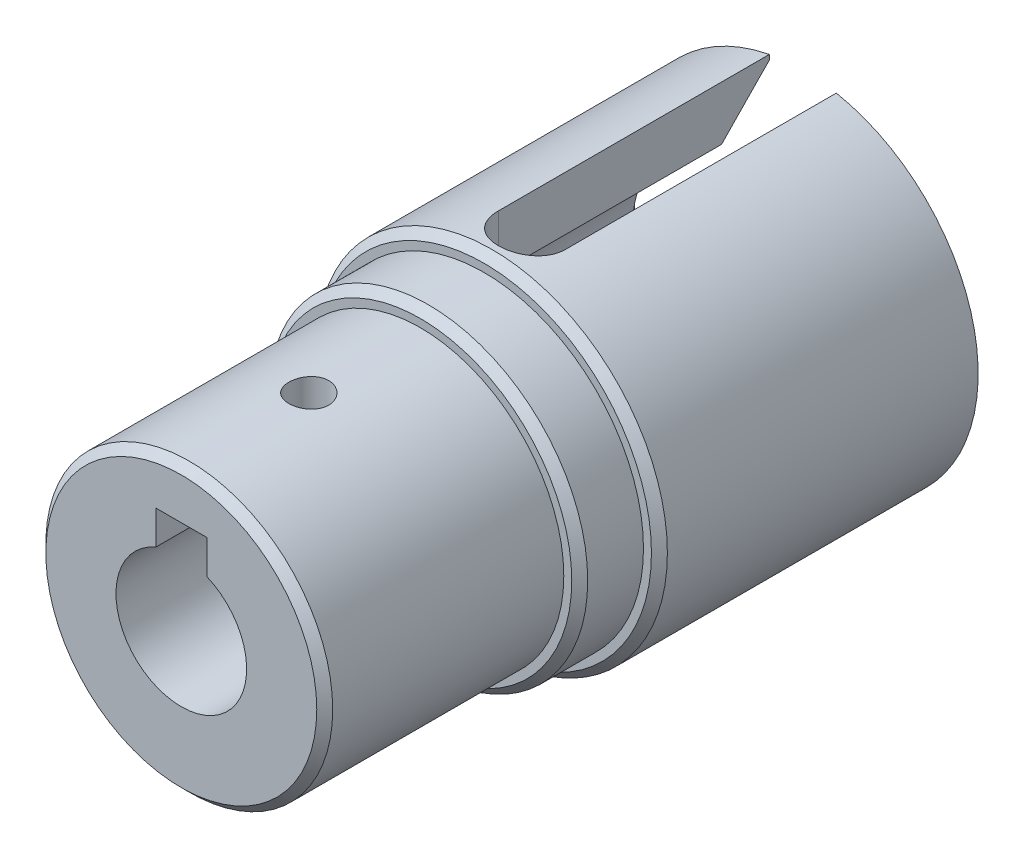
from build123d import *

# Parameters (mm, degrees)
SKETCH_1_R           = 11
EXTRUDE_1_DEPTH      = 29
SKETCH_2_OUTSIDE_W   = 32.506
SKETCH_2_OUTSIDE_H   = 32.506
SKETCH_2_OUTSIDE_R   = 10
CUT_EXTRUDE_1_DEPTH  = 9
SKETCH_3_R           = 7.7
CUT_EXTRUDE_2_DEPTH  = 20
SKETCH_4_R           = 2.1
CUT_EXTRUDE_3_DEPTH  = 25
CHAMFER_1_SIZE       = 3
EXTRUDE_START        = 10
SKETCH_5_R           = 10
EXTRUDE_2_DEPTH      = 10
SKETCH_6_R           = 4
CUT_EXTRUDE_5_DEPTH  = 19
SKETCH_8_OUTSIDE_W   = 33.978
SKETCH_8_OUTSIDE_H   = 33.978
SKETCH_8_OUTSIDE_R   = 9
CUT_EXTRUDE_7_DEPTH  = 15
SKETCH_9_R           = 1.25
CUT_EXTRUDE_8_DEPTH  = 25
CHAMFER_3_SIZE       = 0.5
CUT_EXTRUDE_9_DEPTH  = 19
CUT_EXTRUDE_10_DEPTH = 19


with BuildPart() as part:
    # 草图1 → 凸台-拉伸1 (new body)
    with BuildSketch(Plane.XY):
        with Locations(Location((0, 0, 0), (0, 0, 180))):
            Circle(SKETCH_1_R)
    extrude(amount=EXTRUDE_1_DEPTH)

    # 草图2 outside → 切除-拉伸1 (cut)
    with BuildSketch(Plane.XY.offset(29)):
        Rectangle(SKETCH_2_OUTSIDE_W, SKETCH_2_OUTSIDE_H)
        Circle(SKETCH_2_OUTSIDE_R, mode=Mode.SUBTRACT)
    extrude(amount=-CUT_EXTRUDE_1_DEPTH, mode=Mode.SUBTRACT)

    # 草图3 → 切除-拉伸2 (cut)
    with BuildSketch(Plane(origin=(0, 0, 0), x_dir=(-1, 0, 0), z_dir=(0, 0, -1))):
        Circle(SKETCH_3_R)
    extrude(amount=-CUT_EXTRUDE_2_DEPTH, mode=Mode.SUBTRACT)

    # 草图4 → 切除-拉伸3 (cut, symmetric)
    with BuildSketch(Plane(origin=(0, 0, 0), x_dir=(1, 0, 0), z_dir=(0, 1, 0))):
        with BuildLine():
            Line((-2.1, 0), (-2.1, -17))
            ThreePointArc((-2.1, -17), (0, -14.9), (2.1, -17))
            Line((2.1, -17), (2.1, 0))
            Line((2.1, 0), (-2.1, 0))
        make_face()
        with Locations((0, -17)):
            Circle(SKETCH_4_R)
    extrude(amount=CUT_EXTRUDE_3_DEPTH, both=True, mode=Mode.SUBTRACT)

    # 倒角1
    chamfer_1_edges = [part.edges().sort_by_distance(p)[0] for p in [
        (7.7, 0, 0),
        (-6.142475071, -4.643274706, 0),
    ]]
    chamfer(chamfer_1_edges, length=CHAMFER_1_SIZE)

    # 草图5 → 凸台-拉伸2 (add)
    with BuildSketch(Plane.XY.offset(29).offset(EXTRUDE_START)):
        Circle(SKETCH_5_R)
    extrude(amount=-EXTRUDE_2_DEPTH)

    # 草图6 → 切除-拉伸5 (cut)
    with BuildSketch(Plane.XY.offset(39)):
        Circle(SKETCH_6_R)
    extrude(amount=-CUT_EXTRUDE_5_DEPTH, mode=Mode.SUBTRACT)

    # 草图8 outside → 切除-拉伸7 (cut)
    with BuildSketch(Plane.XY.offset(39)):
        Rectangle(SKETCH_8_OUTSIDE_W, SKETCH_8_OUTSIDE_H)
        Circle(SKETCH_8_OUTSIDE_R, mode=Mode.SUBTRACT)
    extrude(amount=-CUT_EXTRUDE_7_DEPTH, mode=Mode.SUBTRACT)

    # 草图9 → 切除-拉伸8 (cut, symmetric)
    with BuildSketch(Plane(origin=(0, 0, 0), x_dir=(1, 0, 0), z_dir=(0, 1, 0))):
        with Locations(Location((0, -31, 0), (0, 0, 270))):
            Circle(SKETCH_9_R)
    extrude(amount=CUT_EXTRUDE_8_DEPTH, both=True, mode=Mode.SUBTRACT)

    # 倒角3
    chamfer_3_edges = [part.edges().sort_by_distance(p)[0] for p in [
        (-10, 0, 24),
        (-9, 0, 39),
        (11, 0, 20),
    ]]
    chamfer(chamfer_3_edges, length=CHAMFER_3_SIZE)

    # 草图10 → 切除-拉伸9 (cut)
    with BuildSketch(Plane.XY.offset(39)):
        with BuildLine():
            Line((0, 5.8), (0, 4))
            ThreePointArc((0, 4), (0.76406905, 3.92634671), (1.5, 3.708099244))
            Line((1.5, 3.708099244), (1.5, 5.8))
            Line((1.5, 5.8), (0, 5.8))
        make_face()
        with BuildLine():
            ThreePointArc((-1.5, 3.708099244), (-0.76406905, 3.92634671), (0, 4))
            Line((0, 4), (0, 5.8))
            Line((0, 5.8), (-1.5, 5.8))
            Line((-1.5, 5.8), (-1.5, 3.708099244))
        make_face()
    extrude(amount=-CUT_EXTRUDE_9_DEPTH, mode=Mode.SUBTRACT)

    # 草图11 → 切除-拉伸10 (cut)
    with BuildSketch(Plane.XY.offset(39)):
        with BuildLine():
            Line((1.6, 3.774917218), (1.6, 5.9))
            Line((1.6, 5.9), (-1.6, 5.9))
            Line((-1.6, 5.9), (-1.6, 3.774917218))
            ThreePointArc((-1.6, 3.774917218), (0, -4.1), (1.6, 3.774917218))
        make_face()
    extrude(amount=-CUT_EXTRUDE_10_DEPTH, mode=Mode.SUBTRACT)


solid = part.part
